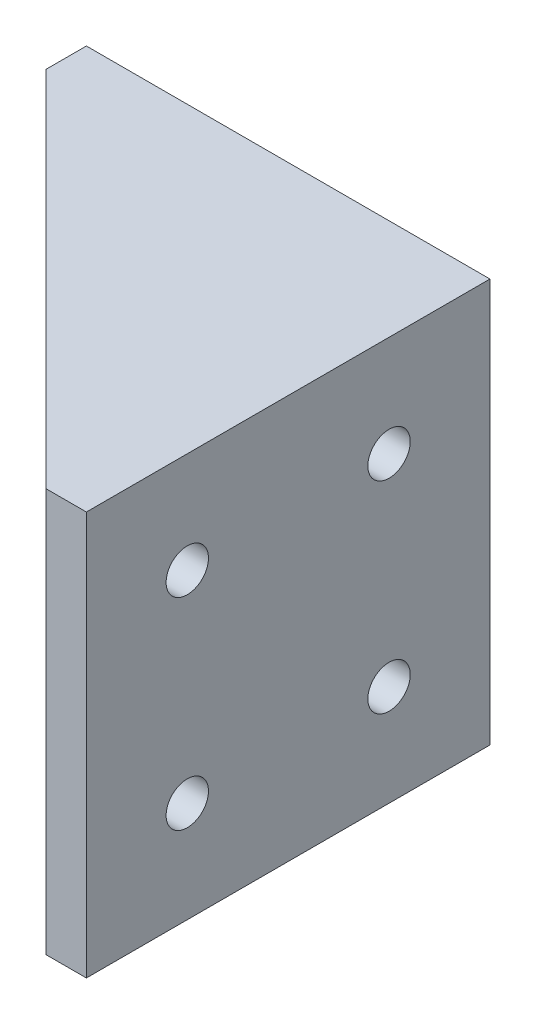
from build123d import *

# Parameters (mm, degrees)
BOSS_EXTRUDE1_DEPTH = 40
SKETCH2_R           = 2.1
CUT_EXTRUDE1_DEPTH  = 40
SKETCH3_R           = 2.1
CUT_EXTRUDE2_DEPTH  = 40
BOSS_EXTRUDE2_DEPTH = 4
BOSS_EXTRUDE3_DEPTH = 4


with BuildPart() as part:
    # Sketch1 → Boss-Extrude1 (new body)
    with BuildSketch(Plane(origin=(0, 0, 0), x_dir=(1, 0, 0), z_dir=(0, 1, 0))):
        Polygon((0, 0), (0, 40), (-40, 40), (-40, 36), (-4, 36), (-4, 0), align=None)
    extrude(amount=BOSS_EXTRUDE1_DEPTH)

    # Sketch2 → Cut-Extrude1 (cut)
    with BuildSketch(Plane(origin=(0, 0, -40), x_dir=(-1, 0, 0), z_dir=(0, 0, -1))):
        with Locations((30, 30)):
            Circle(SKETCH2_R)
        with Locations((30, 10)):
            Circle(SKETCH2_R)
        with Locations((10, 10)):
            Circle(SKETCH2_R)
        with Locations((10, 30)):
            Circle(SKETCH2_R)
    extrude(amount=-CUT_EXTRUDE1_DEPTH, mode=Mode.SUBTRACT)

    # Sketch3 → Cut-Extrude2 (cut)
    with BuildSketch(Plane(origin=(0, 0, 0), x_dir=(0, 0, -1), z_dir=(1, 0, 0))):
        with Locations((10, 30)):
            Circle(SKETCH3_R)
        with Locations((30, 30)):
            Circle(SKETCH3_R)
        with Locations((30, 10)):
            Circle(SKETCH3_R)
        with Locations((10, 10)):
            Circle(SKETCH3_R)
    extrude(amount=-CUT_EXTRUDE2_DEPTH, mode=Mode.SUBTRACT)

    # Sketch4 → Boss-Extrude2 (add)
    with BuildSketch(Plane(origin=(0, 40, 0), x_dir=(1, 0, 0), z_dir=(0, 1, 0))):
        Polygon((-40, 36), (-4, 0), (-4, 36), align=None)
    extrude(amount=-BOSS_EXTRUDE2_DEPTH)

    # Sketch5 → Boss-Extrude3 (add)
    with BuildSketch(Plane.XZ):
        Polygon((-4, -36), (-4, 0), (-40, -36), align=None)
    extrude(amount=-BOSS_EXTRUDE3_DEPTH)


solid = part.part
